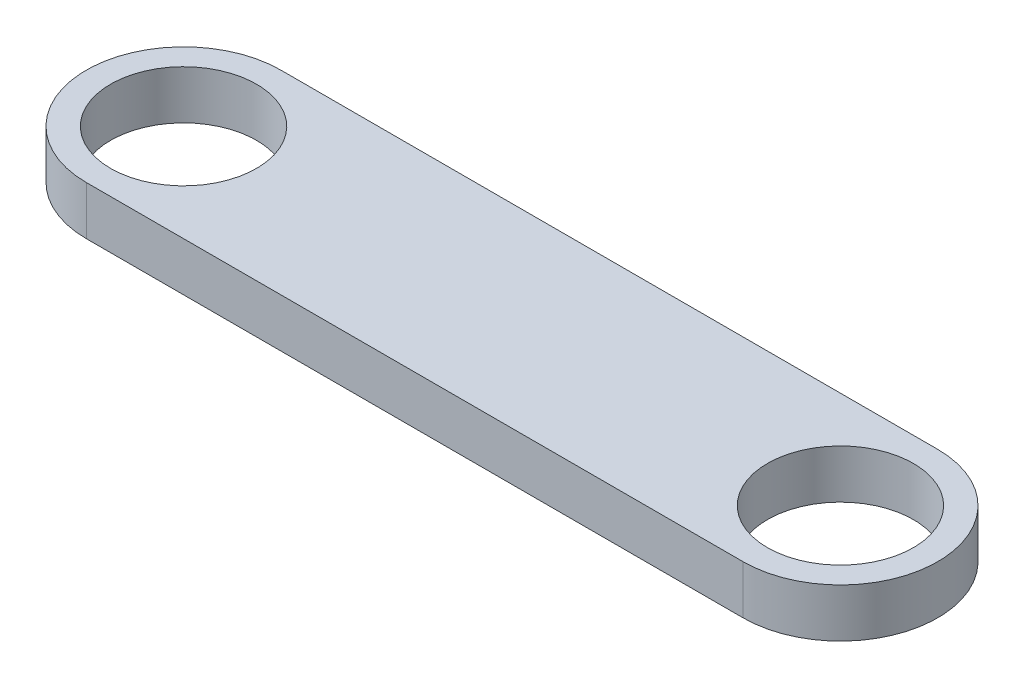
from build123d import *

# Parameters (mm, degrees)
SKETCH1_R           = 15
BOSS_EXTRUDE1_DEPTH = 10
SKETCH2_R           = 15
CUT_EXTRUDE1_DEPTH  = 10


with BuildPart() as part:
    # Sketch1 → Boss-Extrude1 (new body)
    with BuildSketch(Plane(origin=(0, 0, 0), x_dir=(1, 0, 0), z_dir=(0, 1, 0))):
        with BuildLine():
            Line((-134.186746988, 20), (0.813253012, 20))
            ThreePointArc((0.813253012, 20), (20.813253012, 0), (0.813253012, -20))
            Line((0.813253012, -20), (-134.186746988, -20))
            ThreePointArc((-134.186746988, -20), (-154.186746988, 0), (-134.186746988, 20))
        make_face()
        with Locations(Location((-134.186746988, 0, 0), (0, 0, 270))):
            Circle(SKETCH1_R, mode=Mode.SUBTRACT)
    extrude(amount=BOSS_EXTRUDE1_DEPTH)

    # Sketch2 → Cut-Extrude1 (cut)
    with BuildSketch(Plane(origin=(0, 10, 0), x_dir=(1, 0, 0), z_dir=(0, 1, 0))):
        with Locations(Location((0.813253012, 0, 0), (0, 0, 270))):
            Circle(SKETCH2_R)
    extrude(amount=-CUT_EXTRUDE1_DEPTH, mode=Mode.SUBTRACT)


solid = part.part
